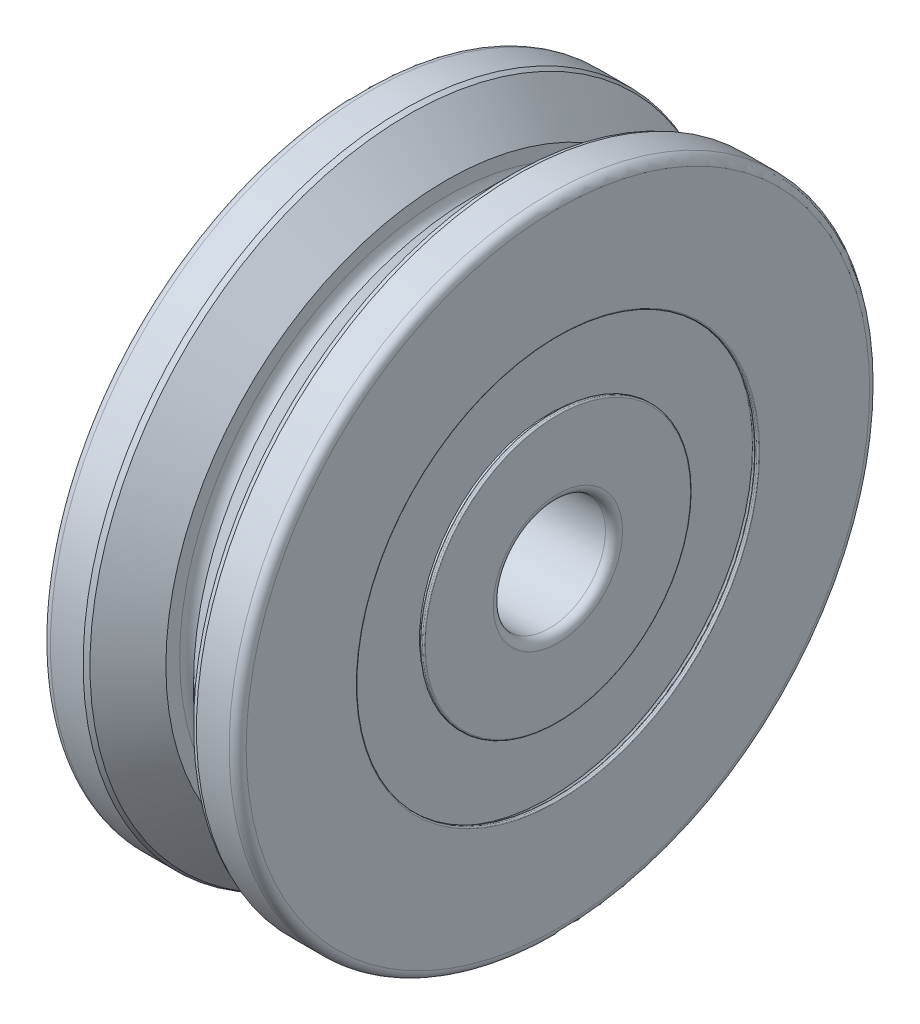
from build123d import *


with BuildPart() as part:
    # Sketch1 → Revolve1 (revolve)
    with BuildSketch(Plane.XY, mode=Mode.PRIVATE) as revolve1_sk:
        with BuildLine():
            Line((-6.9977, 9.4869), (-6.9977, 4.6228))
            ThreePointArc((-6.9977, 4.6228), (-6.819152294, 4.191747706), (-6.3881, 4.0132))
            Line((-6.3881, 4.0132), (6.3881, 4.0132))
            ThreePointArc((6.3881, 4.0132), (6.819152294, 4.191747706), (6.9977, 4.6228))
            Line((6.9977, 4.6228), (6.9977, 9.4869))
            ThreePointArc((6.9977, 9.4869), (6.967942049, 9.558742049), (6.8961, 9.5885))
            Line((6.8961, 9.5885), (6.7945, 9.5885))
            ThreePointArc((6.7945, 9.5885), (6.722657951, 9.558742049), (6.6929, 9.4869))
            Line((6.6929, 9.4869), (6.6929, 9.2837))
            Line((6.6929, 9.2837), (6.3881, 9.2837))
            Line((6.3881, 9.2837), (6.3881, 14.52245))
            ThreePointArc((6.3881, 14.52245), (6.417857951, 14.594292049), (6.4897, 14.62405))
            Line((6.4897, 14.62405), (6.6929, 14.62405))
            Line((6.6929, 14.62405), (6.6929, 14.42085))
            ThreePointArc((6.6929, 14.42085), (6.722657951, 14.349007951), (6.7945, 14.31925))
            Line((6.7945, 14.31925), (6.8961, 14.31925))
            ThreePointArc((6.8961, 14.31925), (6.967942049, 14.349007951), (6.9977, 14.42085))
            Line((6.9977, 14.42085), (6.9977, 22.2885))
            ThreePointArc((6.9977, 22.2885), (6.819152294, 22.719552294), (6.3881, 22.8981))
            Line((6.3881, 22.8981), (4.050856045, 22.8981))
            Line((4.050856045, 22.8981), (3.703971947, 22.754415903))
            Line((3.703971947, 22.754415903), (0.990599999, 20.041043955))
            Line((0.990599999, 20.041043955), (0.990599999, 19.050000001))
            ThreePointArc((0.990599999, 19.050000001), (0, 18.059400002), (-0.990599999, 19.050000001))
            Line((-0.990599999, 19.050000001), (-0.990599999, 20.041043955))
            Line((-0.990599999, 20.041043955), (-3.703971947, 22.754415903))
            Line((-3.703971947, 22.754415903), (-4.050856045, 22.8981))
            Line((-4.050856045, 22.8981), (-6.3881, 22.8981))
            ThreePointArc((-6.3881, 22.8981), (-6.819152294, 22.719552294), (-6.9977, 22.2885))
            Line((-6.9977, 22.2885), (-6.9977, 14.42085))
            ThreePointArc((-6.9977, 14.42085), (-6.967942049, 14.349007951), (-6.8961, 14.31925))
            Line((-6.8961, 14.31925), (-6.7945, 14.31925))
            ThreePointArc((-6.7945, 14.31925), (-6.722657951, 14.349007951), (-6.6929, 14.42085))
            Line((-6.6929, 14.42085), (-6.6929, 14.62405))
            Line((-6.6929, 14.62405), (-6.4897, 14.62405))
            ThreePointArc((-6.4897, 14.62405), (-6.417857951, 14.594292049), (-6.3881, 14.52245))
            Line((-6.3881, 14.52245), (-6.3881, 9.2837))
            Line((-6.3881, 9.2837), (-6.6929, 9.2837))
            Line((-6.6929, 9.2837), (-6.6929, 9.4869))
            ThreePointArc((-6.6929, 9.4869), (-6.722657951, 9.558742049), (-6.7945, 9.5885))
            Line((-6.7945, 9.5885), (-6.8961, 9.5885))
            ThreePointArc((-6.8961, 9.5885), (-6.967942049, 9.558742049), (-6.9977, 9.4869))
        make_face()
    revolve(revolve1_sk.sketch.rotate(Axis((-6.9977, 0, 0), (1, 0, 0)), 270), axis=Axis((-6.9977, 0, 0), (1, 0, 0)))


solid = part.part
